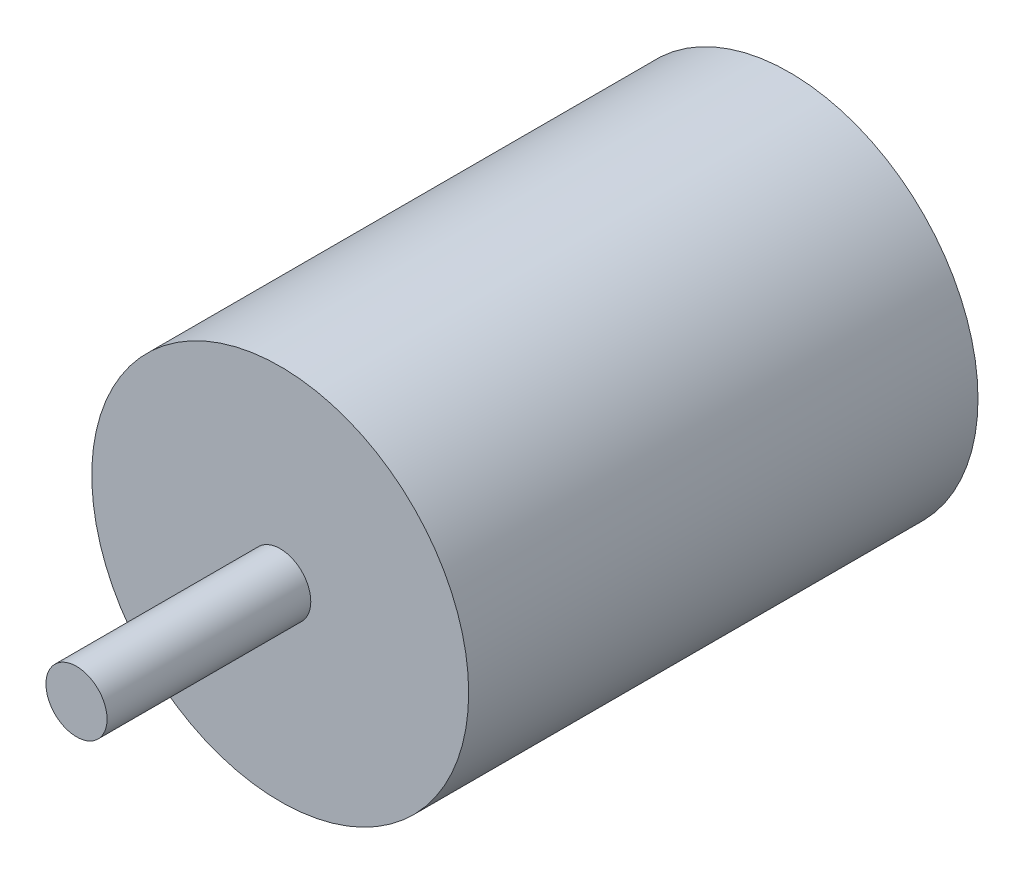
from build123d import *

# Parameters (mm, degrees)
SKETCH1_R           = 18.5
BOSS_EXTRUDE1_DEPTH = 50
SKETCH2_R           = 3
BOSS_EXTRUDE2_DEPTH = 20


with BuildPart() as part:
    # Sketch1 → Boss-Extrude1 (new body)
    with BuildSketch(Plane.XY):
        Circle(SKETCH1_R)
    extrude(amount=BOSS_EXTRUDE1_DEPTH)

    # Sketch2 → Boss-Extrude2 (add)
    with BuildSketch(Plane.XY.offset(50)):
        Circle(SKETCH2_R)
    extrude(amount=BOSS_EXTRUDE2_DEPTH)


solid = part.part
